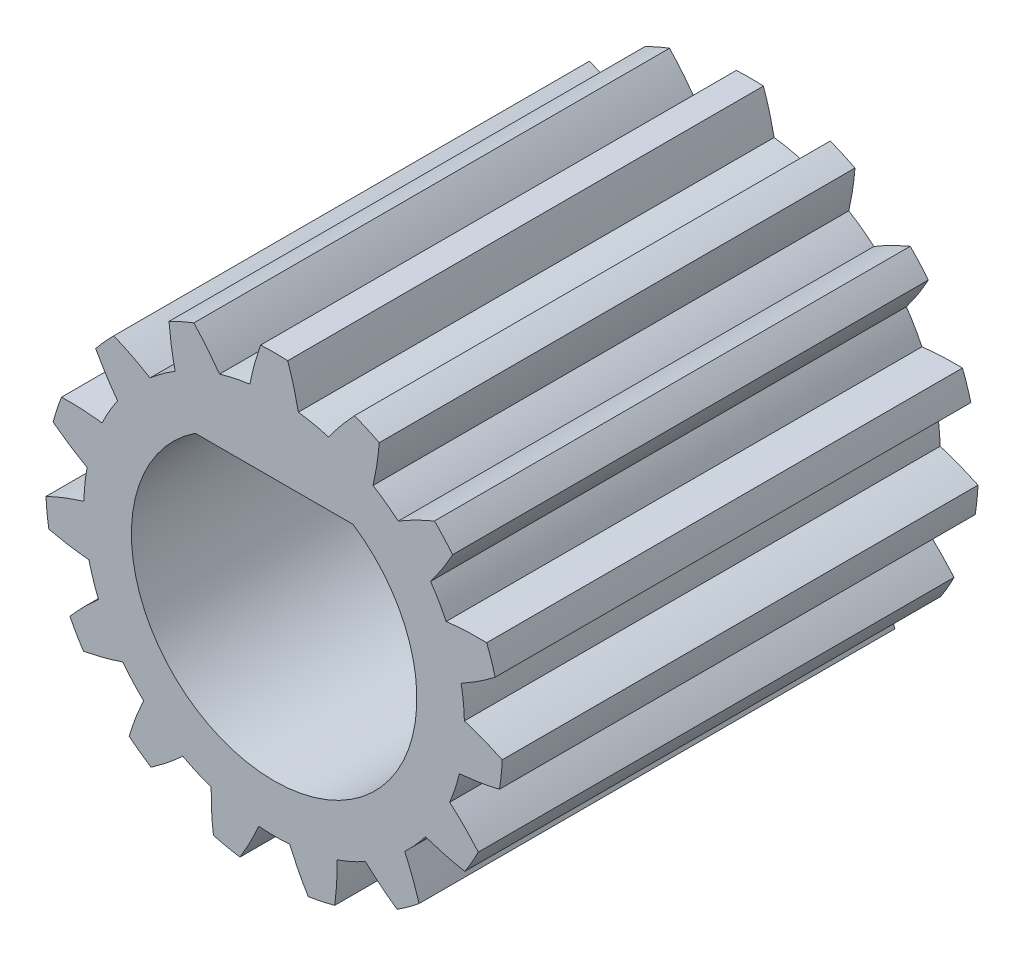
from build123d import *

# Parameters (mm, degrees)
SKETCH1_R           = 4
BOSS_EXTRUDE1_DEPTH = 5
BOSS_EXTRUDE2_DEPTH = 5
CIRPATTERN1_COUNT   = 15


with BuildPart() as part:
    # Sketch1 → Boss-Extrude1 (new, symmetric)
    with BuildSketch(Plane.XY):
        Circle(SKETCH1_R)
        with BuildLine():
            Line((-1.658312395, 2.5), (1.658312395, 2.5))
            ThreePointArc((1.658312395, 2.5), (0, -3), (-1.658312395, 2.5))
        make_face(mode=Mode.SUBTRACT)
    extrude(amount=BOSS_EXTRUDE1_DEPTH, both=True)

    # Sketch2 → Boss-Extrude2 (add, symmetric)
    with BuildSketch(Plane.XY):
        with BuildLine():
            ThreePointArc((0.284809905, 4.791542895), (0, 4.8), (-0.284809905, 4.791542895))
            add(Edge.make_bspline(
                [(-0.284809905, 4.791542895), (-0.427431664, 4.387689215), (-0.509356643, 3.967436932)],
                knots=[0, 0, 0, 1, 1, 1], degree=2))
            ThreePointArc((-0.509356643, 3.967436932), (0, 4), (0.509356643, 3.967436932))
            add(Edge.make_bspline(
                [(0.284809905, 4.791542895), (0.427431664, 4.387689215), (0.509356643, 3.967436932)],
                knots=[0, 0, 0, 1, 1, 1], degree=2))
        make_face()
    boss_extrude2 = extrude(amount=BOSS_EXTRUDE2_DEPTH, both=True)

    # CirPattern1: Boss-Extrude2 ×15 about axis
    cirpattern1_axis = Axis((0, 0, 5), (0, 0, -1))
    for i in range(1, CIRPATTERN1_COUNT):
        add(boss_extrude2.rotate(cirpattern1_axis, i * 360 / CIRPATTERN1_COUNT))


solid = part.part
